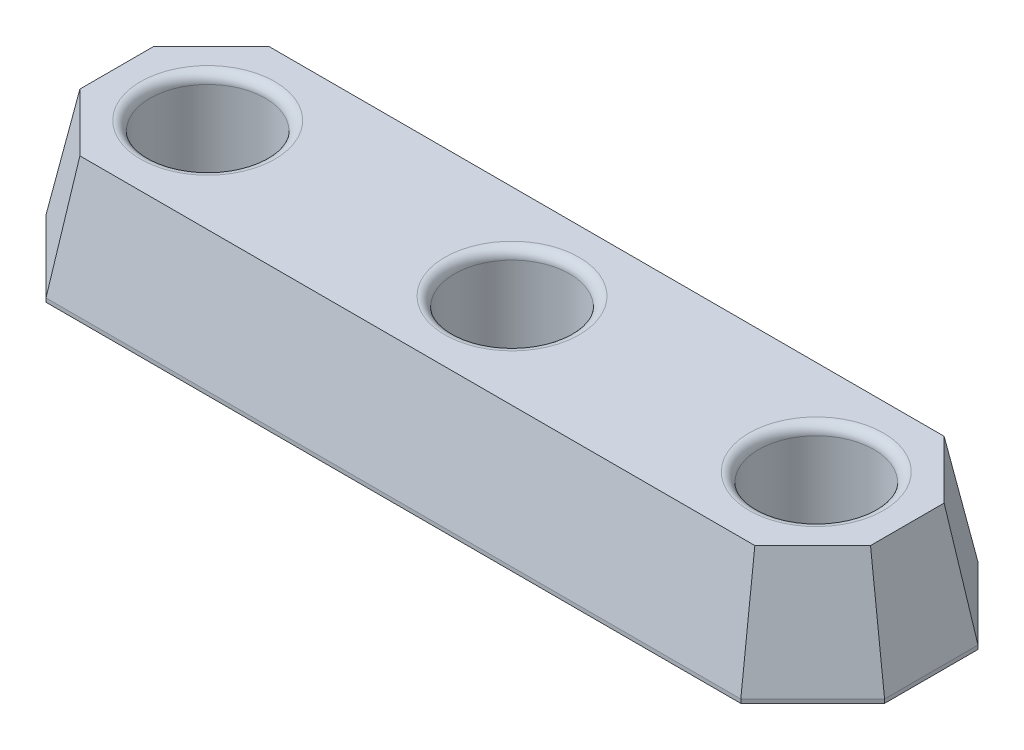
from build123d import *
from OCP.BRepFilletAPI import BRepFilletAPI_MakeChamfer

# Parameters (mm, degrees)
SKETCH1_W           = 35
SKETCH1_H           = 9.9
SKETCH1_R           = 2.404163056
BOSS_EXTRUDE1_DEPTH = 5
CHAMFER1_SIZE       = 3
CHAMFER2_SIZE       = 4.84
CHAMFER2_SIZE2      = 1
FILLET1_R           = 0.4


with BuildPart() as part:
    # Sketch1 → Boss-Extrude1 (new body)
    with BuildSketch(Plane(origin=(0, 0, 0), x_dir=(1, 0, 0), z_dir=(0, 1, 0))):
        with Locations((17.5, 4.95)):
            Rectangle(SKETCH1_W, SKETCH1_H)
        with Locations(Location((4.8, 4.95, 0), (0, 0, 270))):
            Circle(SKETCH1_R, mode=Mode.SUBTRACT)
        with Locations(Location((17.5, 4.95, 0), (0, 0, 270))):
            Circle(SKETCH1_R, mode=Mode.SUBTRACT)
        with Locations(Location((30.2, 4.95, 0), (0, 0, 270))):
            Circle(SKETCH1_R, mode=Mode.SUBTRACT)
    extrude(amount=BOSS_EXTRUDE1_DEPTH)

    # Chamfer1
    chamfer1_edges = [part.edges().sort_by_distance(p)[0] for p in [
        (0, 2.5, -9.9),
        (35, 2.5, -9.9),
        (35, 2.5, 0),
        (0, 2.5, 0),
    ]]
    chamfer(chamfer1_edges, length=CHAMFER1_SIZE)

    # Chamfer2: one chamfer whose edges measure the first distance from different faces: ONE call of the kernel's chamfer builder (chamfer() names one face for all edges)
    chamfer2_edges_1 = [part.edges().sort_by_distance(p)[0] for p in [
        (35, 5, -4.95),
    ]]
    chamfer2_side_1 = [part.faces().sort_by_distance(p)[0] for p in [
        (35, 2.5, -4.95),
    ]]
    chamfer2_edges_2 = [part.edges().sort_by_distance(p)[0] for p in [
        (17.5, 5, 0),
    ]]
    chamfer2_side_2 = [part.faces().sort_by_distance(p)[0] for p in [
        (17.5, 2.5, 0),
    ]]
    chamfer2_edges_3 = [part.edges().sort_by_distance(p)[0] for p in [
        (0, 5, -4.95),
    ]]
    chamfer2_side_3 = [part.faces().sort_by_distance(p)[0] for p in [
        (0, 2.5, -4.95),
    ]]
    chamfer2_edges_4 = [part.edges().sort_by_distance(p)[0] for p in [
        (17.5, 5, -9.9),
    ]]
    chamfer2_side_4 = [part.faces().sort_by_distance(p)[0] for p in [
        (17.5, 2.5, -9.9),
    ]]
    chamfer2_edges_5 = [part.edges().sort_by_distance(p)[0] for p in [
        (1.5, 5, -1.5),
    ]]
    chamfer2_side_5 = [part.faces().sort_by_distance(p)[0] for p in [
        (1.5, 2.5, -1.5),
    ]]
    chamfer2_edges_6 = [part.edges().sort_by_distance(p)[0] for p in [
        (1.5, 5, -8.4),
    ]]
    chamfer2_side_6 = [part.faces().sort_by_distance(p)[0] for p in [
        (1.5, 2.5, -8.4),
    ]]
    chamfer2_edges_7 = [part.edges().sort_by_distance(p)[0] for p in [
        (33.5, 5, -8.4),
    ]]
    chamfer2_side_7 = [part.faces().sort_by_distance(p)[0] for p in [
        (33.5, 2.5, -8.4),
    ]]
    chamfer2_edges_8 = [part.edges().sort_by_distance(p)[0] for p in [
        (33.5, 5, -1.5),
    ]]
    chamfer2_side_8 = [part.faces().sort_by_distance(p)[0] for p in [
        (33.5, 2.5, -1.5),
    ]]
    chamfer2 = BRepFilletAPI_MakeChamfer(part.part.solid().wrapped)
    for e in chamfer2_edges_1:
        chamfer2.Add(CHAMFER2_SIZE, CHAMFER2_SIZE2, e.wrapped, chamfer2_side_1[0].wrapped)  # the first distance lies on this face
    for e in chamfer2_edges_2:
        chamfer2.Add(CHAMFER2_SIZE, CHAMFER2_SIZE2, e.wrapped, chamfer2_side_2[0].wrapped)  # the first distance lies on this face
    for e in chamfer2_edges_3:
        chamfer2.Add(CHAMFER2_SIZE, CHAMFER2_SIZE2, e.wrapped, chamfer2_side_3[0].wrapped)  # the first distance lies on this face
    for e in chamfer2_edges_4:
        chamfer2.Add(CHAMFER2_SIZE, CHAMFER2_SIZE2, e.wrapped, chamfer2_side_4[0].wrapped)  # the first distance lies on this face
    for e in chamfer2_edges_5:
        chamfer2.Add(CHAMFER2_SIZE, CHAMFER2_SIZE2, e.wrapped, chamfer2_side_5[0].wrapped)  # the first distance lies on this face
    for e in chamfer2_edges_6:
        chamfer2.Add(CHAMFER2_SIZE, CHAMFER2_SIZE2, e.wrapped, chamfer2_side_6[0].wrapped)  # the first distance lies on this face
    for e in chamfer2_edges_7:
        chamfer2.Add(CHAMFER2_SIZE, CHAMFER2_SIZE2, e.wrapped, chamfer2_side_7[0].wrapped)  # the first distance lies on this face
    for e in chamfer2_edges_8:
        chamfer2.Add(CHAMFER2_SIZE, CHAMFER2_SIZE2, e.wrapped, chamfer2_side_8[0].wrapped)  # the first distance lies on this face
    add(Compound.cast(chamfer2.Shape()), mode=Mode.REPLACE)

    # Fillet1
    fillet1_edges = [part.edges().sort_by_distance(p)[0] for p in [
        (4.8, 0, -7.354163056),
        (4.8, 5, -7.354163056),
        (17.5, 0, -7.354163056),
        (17.5, 5, -7.354163056),
        (30.2, 0, -7.354163056),
        (30.2, 5, -7.354163056),
    ]]
    fillet(fillet1_edges, radius=FILLET1_R)


solid = part.part
